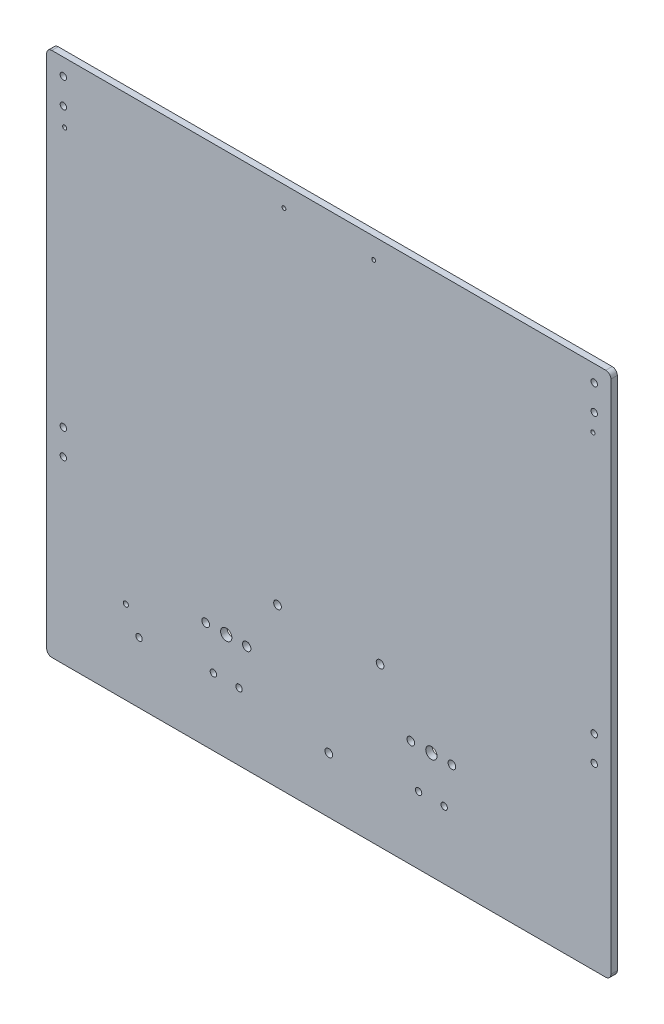
from build123d import *

# Parameters (mm, degrees)
SKETCH1_R           = 2.5
SKETCH1_R_2         = 4.4
SKETCH1_R_3         = 3
SKETCH1_R_4         = 3.279065817
SKETCH1_R_5         = 1.6
BOSS_EXTRUDE1_DEPTH = 5
SKETCH5_R           = 1.5
CUT_EXTRUDE1_DEPTH  = 10
BOSS_EXTRUDE2_DEPTH = 5
SKETCH7_R           = 2
CUT_EXTRUDE2_DEPTH  = 10


with BuildPart() as part:
    # Sketch1 → Boss-Extrude1 (new body)
    with BuildSketch(Plane(origin=(0, 0, 0), x_dir=(-1, 0, 0), z_dir=(0, 0, -1))):
        with BuildLine():
            Line((-134.326613086, -194.301333572), (285.673386914, -194.301333572))
            ThreePointArc((285.673386914, -194.301333572), (292.744454726, -191.372401383), (295.673386914, -184.301333572))
            Line((295.673386914, -184.301333572), (295.673386914, 205.698666428))
            ThreePointArc((295.673386914, 205.698666428), (292.744454726, 212.76973424), (285.673386914, 215.698666428))
            Line((285.673386914, 215.698666428), (-134.326613086, 215.698666428))
            ThreePointArc((-134.326613086, 215.698666428), (-141.397680897, 212.76973424), (-144.326613086, 205.698666428))
            Line((-144.326613086, 205.698666428), (-144.326613086, -184.301333572))
            ThreePointArc((-144.326613086, -184.301333572), (-141.397680897, -191.372401383), (-134.326613086, -194.301333572))
        make_face()
        with Locations(Location((282.673386914, 202.698666428, 0), (0, 0, 180))):
            Circle(SKETCH1_R, mode=Mode.SUBTRACT)
        with Locations(Location((282.673386914, 182.698666428, 0), (0, 0, 180))):
            Circle(SKETCH1_R, mode=Mode.SUBTRACT)
        with Locations(Location((282.673386914, -34.301333572, 0), (0, 0, 180))):
            Circle(SKETCH1_R, mode=Mode.SUBTRACT)
        with Locations(Location((282.673386914, -54.301333572, 0), (0, 0, 180))):
            Circle(SKETCH1_R, mode=Mode.SUBTRACT)
        with Locations(Location((-131.326613086, 202.698666428, 0), (0, 0, 180))):
            Circle(SKETCH1_R, mode=Mode.SUBTRACT)
        with Locations(Location((-131.326613086, 182.698666428, 0), (0, 0, 180))):
            Circle(SKETCH1_R, mode=Mode.SUBTRACT)
        with Locations(Location((-131.326613086, -34.301333572, 0), (0, 0, 180))):
            Circle(SKETCH1_R, mode=Mode.SUBTRACT)
        with Locations(Location((-131.326613086, -54.301333572, 0), (0, 0, 180))):
            Circle(SKETCH1_R, mode=Mode.SUBTRACT)
        with Locations(Location((165.673386914, -141.801333572, 0), (0, 0, 180))):
            Circle(SKETCH1_R, mode=Mode.SUBTRACT)
        with Locations(Location((145.673386914, -141.801333572, 0), (0, 0, 180))):
            Circle(SKETCH1_R, mode=Mode.SUBTRACT)
        with Locations(Location((5.673386914, -141.801333572, 0), (0, 0, 180))):
            Circle(SKETCH1_R, mode=Mode.SUBTRACT)
        with Locations(Location((-14.326613086, -141.801333572, 0), (0, 0, 180))):
            Circle(SKETCH1_R, mode=Mode.SUBTRACT)
        with Locations(Location((-4.326613086, -110.801333572, 0), (0, 0, 180))):
            Circle(SKETCH1_R_2, mode=Mode.SUBTRACT)
        with Locations(Location((155.673386914, -110.801333572, 0), (0, 0, 180))):
            Circle(SKETCH1_R_2, mode=Mode.SUBTRACT)
        with Locations(Location((171.673386914, -110.801333572, 0), (0, 0, 180))):
            Circle(SKETCH1_R_3, mode=Mode.SUBTRACT)
        with Locations(Location((139.673386914, -110.801333572, 0), (0, 0, 180))):
            Circle(SKETCH1_R_4, mode=Mode.SUBTRACT)
        with Locations(Location((11.673386914, -110.801333572, 0), (0, 0, 180))):
            Circle(SKETCH1_R_3, mode=Mode.SUBTRACT)
        with Locations(Location((-20.326613086, -110.801333572, 0), (0, 0, 180))):
            Circle(SKETCH1_R_3, mode=Mode.SUBTRACT)
        with Locations(Location((75.673386914, -150.801333572, 0), (0, 0, 180))):
            Circle(SKETCH1_R_3, mode=Mode.SUBTRACT)
        with Locations(Location((35.673386914, -70.801333572, 0), (0, 0, 180))):
            Circle(SKETCH1_R_3, mode=Mode.SUBTRACT)
        with Locations(Location((115.673386914, -70.801333572, 0), (0, 0, 180))):
            Circle(SKETCH1_R_3, mode=Mode.SUBTRACT)
        with Locations((281.673386914, 168.698666428)):
            Circle(SKETCH1_R_5, mode=Mode.SUBTRACT)
        with Locations((-130.326613086, 168.698666428)):
            Circle(SKETCH1_R_5, mode=Mode.SUBTRACT)
        with Locations((223.673386914, -146.742256115)):
            Circle(SKETCH1_R, mode=Mode.SUBTRACT)
    extrude(amount=-BOSS_EXTRUDE1_DEPTH)

    # Sketch5 → Cut-Extrude1 (cut)
    with BuildSketch(Plane(origin=(0, 0, 0), x_dir=(-1, 0, 0), z_dir=(0, 0, -1))):
        with Locations((40.673386914, 199.698666428)):
            Circle(SKETCH5_R)
        with Locations((110.673386914, 199.698666428)):
            Circle(SKETCH5_R)
    extrude(amount=-CUT_EXTRUDE1_DEPTH, mode=Mode.SUBTRACT)

    # Sketch2 → Boss-Extrude2 (add)
    with BuildSketch(Plane(origin=(0, 0, 0), x_dir=(-1, 0, 0), z_dir=(0, 0, -1))):
        with BuildLine():
            Line((-144.326613086, 205.698666428), (-134.326613086, 205.698666428))
            Line((-134.326613086, 205.698666428), (-134.326613086, 215.698666428))
            Line((-134.326613086, 215.698666428), (-140.326613086, 215.698666428))
            ThreePointArc((-140.326613086, 215.698666428), (-143.15504021, 214.527093553), (-144.326613086, 211.698666428))
            Line((-144.326613086, 211.698666428), (-144.326613086, 205.698666428))
        make_face()
        with BuildLine():
            Line((285.673386914, 205.698666428), (285.673386914, 215.698666428))
            Line((285.673386914, 215.698666428), (291.673386914, 215.698666428))
            ThreePointArc((291.673386914, 215.698666428), (294.501814039, 214.527093553), (295.673386914, 211.698666428))
            Line((295.673386914, 211.698666428), (295.673386914, 205.698666428))
            Line((295.673386914, 205.698666428), (285.673386914, 205.698666428))
        make_face()
        with BuildLine():
            Line((295.673386914, -184.301333572), (285.673386914, -184.301333572))
            Line((285.673386914, -184.301333572), (285.673386914, -194.301333572))
            Line((285.673386914, -194.301333572), (291.673386914, -194.301333572))
            ThreePointArc((291.673386914, -194.301333572), (294.501814039, -193.129760696), (295.673386914, -190.301333572))
            Line((295.673386914, -190.301333572), (295.673386914, -184.301333572))
        make_face()
        with BuildLine():
            Line((-134.326613086, -184.301333572), (-134.326613086, -194.301333572))
            Line((-134.326613086, -194.301333572), (-140.326613086, -194.301333572))
            ThreePointArc((-140.326613086, -194.301333572), (-143.15504021, -193.129760696), (-144.326613086, -190.301333572))
            Line((-144.326613086, -190.301333572), (-144.326613086, -184.301333572))
            Line((-144.326613086, -184.301333572), (-134.326613086, -184.301333572))
        make_face()
    extrude(amount=-BOSS_EXTRUDE2_DEPTH)

    # Sketch7 → Cut-Extrude2 (cut)
    with BuildSketch(Plane.XY.offset(5)):
        with Locations((-233.943763634, -129.374915409)):
            Circle(SKETCH7_R)
    extrude(amount=-CUT_EXTRUDE2_DEPTH, mode=Mode.SUBTRACT)


solid = part.part
